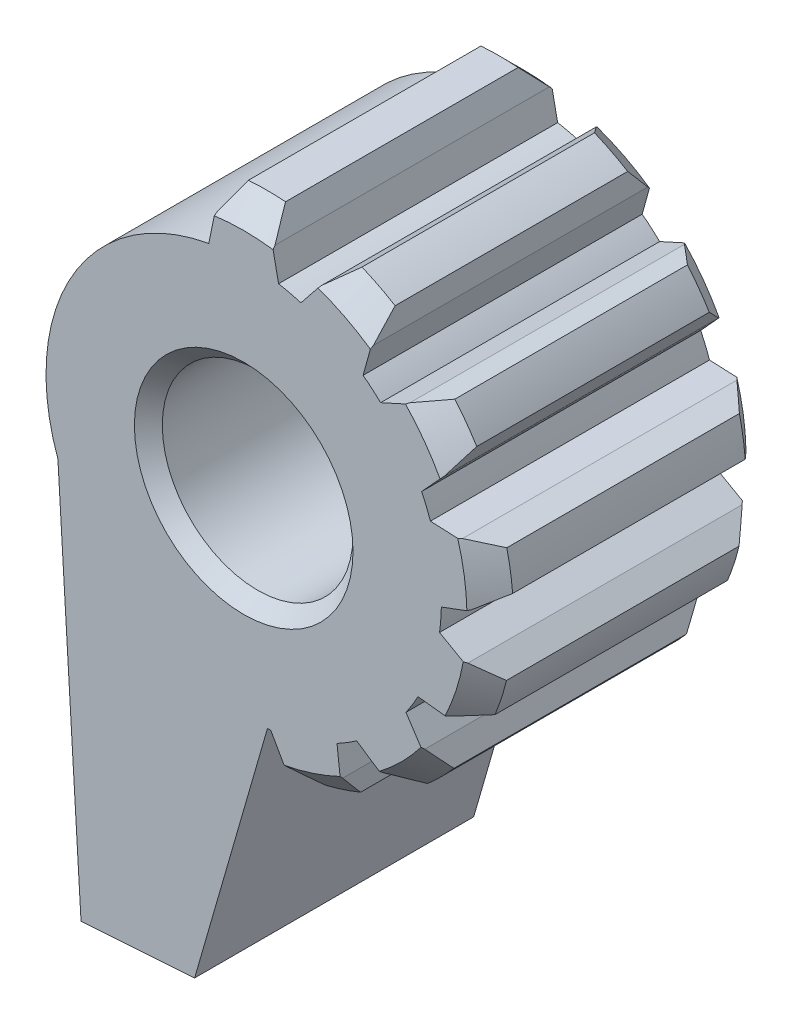
from build123d import *

# Parameters (mm, degrees)
SKETCH_1_R               = 2.05
EXTRUDE_1_DEPTH          = 3
PATTERN_CIRCULAR_1_COUNT = 7
PATTERN_CIRCULAR_1_ANGLE = 162
CHAMFER_1_SIZE           = 0.5
CHAMFER_2_SIZE           = 0.5
CHAMFER_3_SIZE           = 0.3
EXTRUDE_2_DEPTH          = 3


with BuildPart() as part:
    # 스케치1 → 보스-돌출1 (new, symmetric)
    with BuildSketch(Plane.XY):
        with BuildLine():
            ThreePointArc((-0.75, 4.183300133), (0, -4.25), (0.75, 4.183300133))
            Line((0.75, 4.183300133), (0.621752267, 4.811019676))
            Line((0.621752267, 4.811019676), (0.4, 5.284884105))
            ThreePointArc((0.4, 5.284884105), (0, 5.3), (-0.4, 5.284884105))
            Line((-0.4, 5.284884105), (-0.621752267, 4.811019676))
            Line((-0.621752267, 4.811019676), (-0.75, 4.183300133))
        make_face()
        Circle(SKETCH_1_R, mode=Mode.SUBTRACT)
    extrude_1 = extrude(amount=EXTRUDE_1_DEPTH, both=True)

    # 원형 패턴1: 보스-돌출1 ×7 about axis
    pattern_circular_1_axis = Axis((0, 0, 0), (0, 0, -1))
    for i in range(1, PATTERN_CIRCULAR_1_COUNT):
        add(extrude_1.rotate(pattern_circular_1_axis, i * PATTERN_CIRCULAR_1_ANGLE / (PATTERN_CIRCULAR_1_COUNT - 1)))

    # 모따기1
    chamfer_1_edges = [part.edges().sort_by_distance(p)[0] for p in [
        (0, 5.3, -3),
        (1.63779007, -5.040599536, -3),
        (3.74766594, -3.74766594, -3),
        (5.040599536, -1.63779007, -3),
        (5.234748205, 0.829102665, -3),
        (4.28779007, 3.115261837, -3),
        (2.406149649, 4.722334578, -3),
    ]]
    chamfer(chamfer_1_edges, length=CHAMFER_1_SIZE)

    # 모따기2
    chamfer_2_edges = [part.edges().sort_by_distance(p)[0] for p in [
        (0, 5.3, 3),
        (2.406149649, 4.722334578, 3),
        (4.28779007, 3.115261837, 3),
        (5.234748205, 0.829102665, 3),
        (5.040599536, -1.63779007, 3),
        (3.74766594, -3.74766594, 3),
        (1.63779007, -5.040599536, 3),
    ]]
    chamfer(chamfer_2_edges, length=CHAMFER_2_SIZE)

    # 모따기3
    chamfer_3_edges = [part.edges().sort_by_distance(p)[0] for p in [
        (-2.05, 0, 3),
        (-2.05, 0, -3),
    ]]
    chamfer(chamfer_3_edges, length=CHAMFER_3_SIZE)

    # 스케치4 → 보스-돌출2 (add, symmetric)
    with BuildSketch(Plane.XY):
        Polygon((-1.055150369, -9.645655488), (0.510208527, -4.219263829), (-3.994308358, -1.451895569), (-3.497178156, -9.809555456), align=None)
    extrude(amount=EXTRUDE_2_DEPTH, both=True)


solid = part.part
